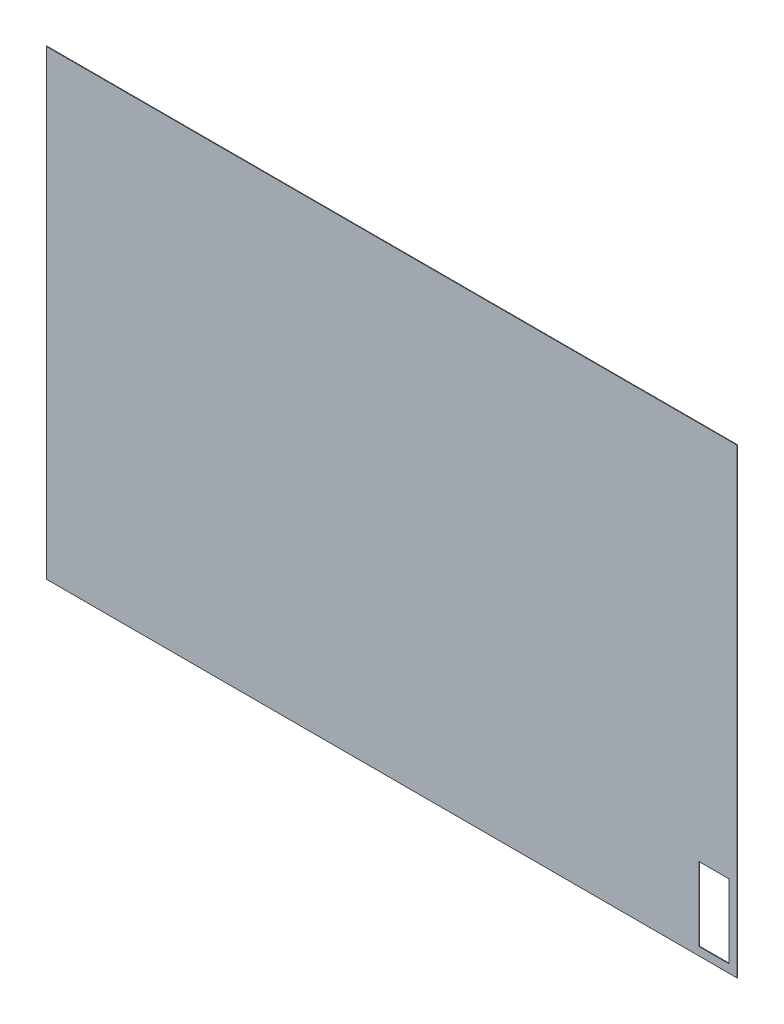
from build123d import *

# Parameters (mm, degrees)
SKETCH1_W           = 2500
SKETCH1_H           = 1670
SKETCH1_W_2         = 108.44
SKETCH1_H_2         = 266
BOSS_EXTRUDE1_DEPTH = 2


with BuildPart() as part:
    # Sketch1 → Boss-Extrude1 (new body)
    with BuildSketch(Plane.XY):
        with Locations((1250, 835)):
            Rectangle(SKETCH1_W, SKETCH1_H)
        with Locations((2415.78, 163)):
            Rectangle(SKETCH1_W_2, SKETCH1_H_2, mode=Mode.SUBTRACT)
    extrude(amount=BOSS_EXTRUDE1_DEPTH)


solid = part.part
